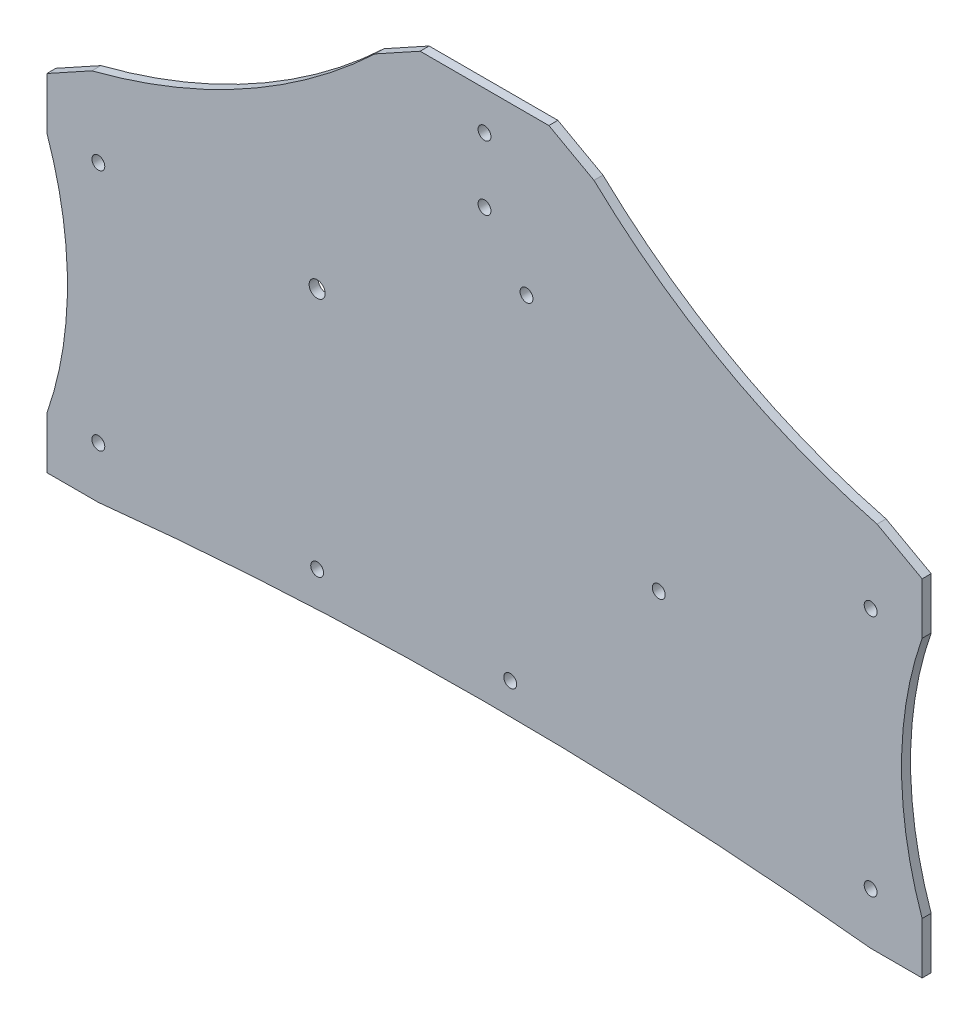
from build123d import *

# Parameters (mm, degrees)
SKETCH2_W           = 635
SKETCH2_H           = 635
BOSS_EXTRUDE3_DEPTH = 4.445
SKETCH3_R           = 3.175
SKETCH3_R_2         = 3.9751
CUT_EXTRUDE1_DEPTH  = 514.410627343
SKETCH5_W           = 635
SKETCH5_H           = 635
CUT_EXTRUDE2_DEPTH  = 514.410627343
CUT_EXTRUDE3_DEPTH  = 359.355916807
SKETCH10_R          = 3.175
CUT_EXTRUDE5_DEPTH  = 359.355916807


with BuildPart() as part:
    # Sketch2 → Boss-Extrude3 (new body)
    with BuildSketch(Plane.XY):
        with Locations((84.381748098, -1.971086)):
            Rectangle(SKETCH2_W, SKETCH2_H)
    extrude(amount=BOSS_EXTRUDE3_DEPTH)

    # Sketch3 → Cut-Extrude1 (cut, through all)
    with BuildSketch(Plane(origin=(0, 0, 0), x_dir=(-1, 0, 0), z_dir=(0, 0, -1))):
        with Locations((-130.02651813, 72.45351862)):
            Circle(SKETCH3_R)
        with Locations((-195.288059763, -21.383687133)):
            Circle(SKETCH3_R)
        with Locations((-122.004659563, -96.265887155)):
            Circle(SKETCH3_R)
        with Locations((-26.754659563, -96.265887155)):
            Circle(SKETCH3_R)
        with Locations((-26.754659563, 23.469712845)):
            Circle(SKETCH3_R_2)
        with Locations((81.195340437, -96.265887155)):
            Circle(SKETCH3_R)
        with Locations((-299.804659563, -96.265887155)):
            Circle(SKETCH3_R)
        with Locations((81.195340437, 23.469712845)):
            Circle(SKETCH3_R)
        with Locations((-299.804659563, 23.469712845)):
            Circle(SKETCH3_R)
    extrude(amount=-CUT_EXTRUDE1_DEPTH, mode=Mode.SUBTRACT)

    # Sketch5 → Cut-Extrude2 (cut, through all)
    with BuildSketch(Plane.XY.offset(4.445)):
        with Locations((84.381748098, -1.971086)):
            Rectangle(SKETCH5_W, SKETCH5_H)
        Polygon((-106.595340437, -121.665887155), (325.204659563, -121.665887155), (325.204659563, 48.869712845), (141.054659563, 150.469712845), (77.554659563, 150.469712845), (-106.595340437, 48.869712845), align=None, mode=Mode.SUBTRACT)
    extrude(amount=-CUT_EXTRUDE2_DEPTH, mode=Mode.SUBTRACT)

    # Sketch7 → Cut-Extrude3 (cut, through all)
    with BuildSketch(Plane.XY.offset(4.445)):
        with BuildLine():
            ThreePointArc((-106.595340437, -96.265887155), (-96.435340437, -36.398087155), (-106.595340437, 23.469712845))
            Line((-106.595340437, 23.469712845), (-106.595340437, -96.265887155))
        make_face()
        with BuildLine():
            ThreePointArc((299.804659563, -121.665887155), (109.304659563, -111.505887155), (-81.195340437, -121.665887155))
            Line((-81.195340437, -121.665887155), (299.804659563, -121.665887155))
        make_face()
        with BuildLine():
            ThreePointArc((325.204659563, 23.469712845), (315.044659563, -36.398087155), (325.204659563, -96.265887155))
            Line((325.204659563, -96.265887155), (325.204659563, 23.469712845))
        make_face()
        with BuildLine():
            Line((55.314986389, 138.199548335), (-84.355667262, 61.139877355))
            ThreePointArc((-84.355667262, 61.139877355), (-9.612274633, 90.773843575), (55.314986389, 138.199548335))
        make_face()
        with BuildLine():
            Line((302.964986389, 61.139877355), (163.294332738, 138.199548335))
            ThreePointArc((163.294332738, 138.199548335), (228.221593759, 90.773843575), (302.964986389, 61.139877355))
        make_face()
    extrude(amount=-CUT_EXTRUDE3_DEPTH, mode=Mode.SUBTRACT)

    # Sketch10 → Cut-Extrude5 (cut, through all)
    with BuildSketch(Plane.XY.offset(4.445)):
        with Locations((109.304659563, 131.419712845)):
            Circle(SKETCH10_R)
        with Locations((109.304659563, 99.669712845)):
            Circle(SKETCH10_R)
    extrude(amount=-CUT_EXTRUDE5_DEPTH, mode=Mode.SUBTRACT)


solid = part.part
